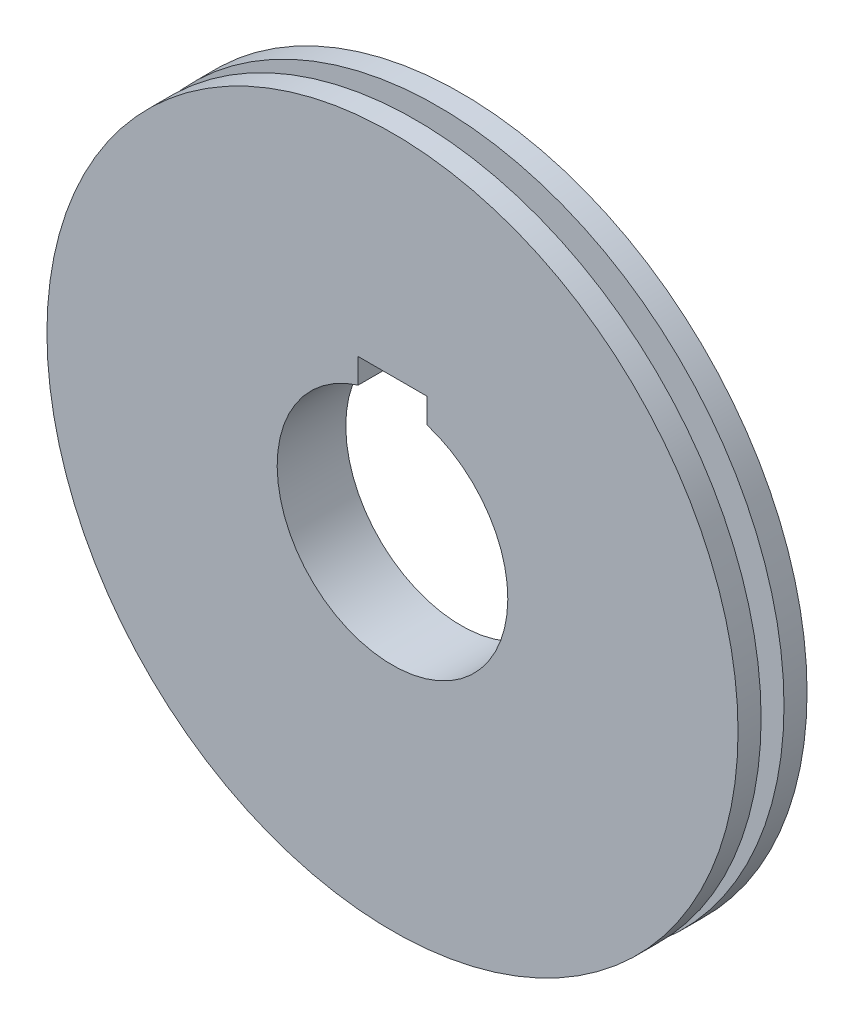
from build123d import *

# Parameters (mm, degrees)
SKETCH1_R           = 60
BOSS_EXTRUDE2_DEPTH = 4
SKETCH2_R           = 20
CUT_EXTRUDE1_DEPTH  = 20.9
SKETCH3_R           = 48.468089367
BOSS_EXTRUDE3_DEPTH = 3.9
SKETCH4_R           = 59.929943569
BOSS_EXTRUDE6_DEPTH = 4
SKETCH8_R           = 20
CUT_EXTRUDE5_DEPTH  = 48
CUT_EXTRUDE6_DEPTH  = 48


with BuildPart() as part:
    # Sketch1 → Boss-Extrude2 (new body)
    with BuildSketch(Plane.XY):
        Circle(SKETCH1_R)
    extrude(amount=BOSS_EXTRUDE2_DEPTH)

    # Sketch2 → Cut-Extrude1 (cut)
    with BuildSketch(Plane.XY.offset(4)):
        Circle(SKETCH2_R)
    extrude(amount=-CUT_EXTRUDE1_DEPTH, mode=Mode.SUBTRACT)

    # Sketch3 → Boss-Extrude3 (add)
    with BuildSketch(Plane.XY.offset(4)):
        Circle(SKETCH3_R)
    extrude(amount=BOSS_EXTRUDE3_DEPTH)

    # Sketch4 → Boss-Extrude6 (add)
    with BuildSketch(Plane.XY.offset(7.9)):
        Circle(SKETCH4_R)
    extrude(amount=BOSS_EXTRUDE6_DEPTH)

    # Sketch8 → Cut-Extrude5 (cut)
    with BuildSketch(Plane.XY.offset(11.9)):
        Circle(SKETCH8_R)
    extrude(amount=-CUT_EXTRUDE5_DEPTH, mode=Mode.SUBTRACT)

    # Sketch9 → Cut-Extrude6 (cut)
    with BuildSketch(Plane.XY.offset(11.9)):
        with BuildLine():
            Line((-5.95, 19.094436362), (-5.95, 23.394436362))
            Line((-5.95, 23.394436362), (5.95, 23.394436362))
            Line((5.95, 23.394436362), (5.95, 19.094436362))
            ThreePointArc((5.95, 19.094436362), (0, 20), (-5.95, 19.094436362))
        make_face()
    extrude(amount=-CUT_EXTRUDE6_DEPTH, mode=Mode.SUBTRACT)


solid = part.part
